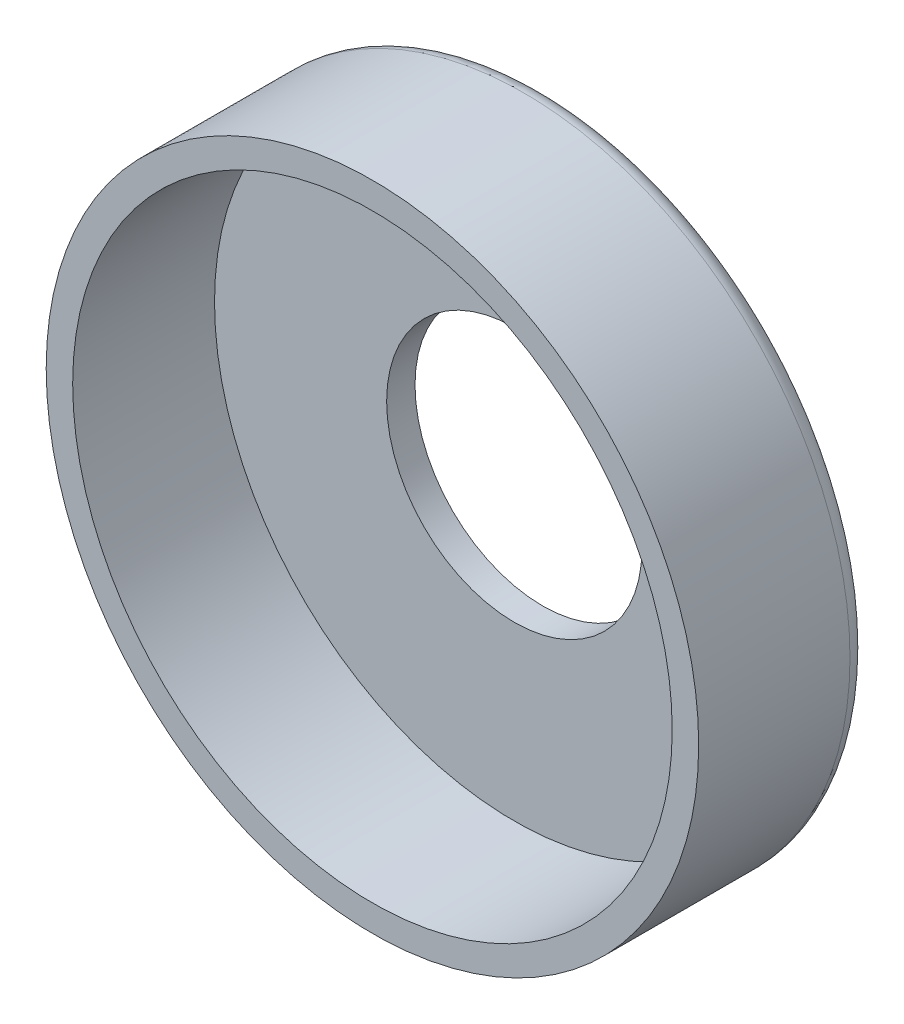
from build123d import *

# Parameters (mm, degrees)
ESQUISSE1_R                  = 34.5
BOSS_EXTRU_1_DEPTH           = 3
ESQUISSE2_R                  = 34.5
ESQUISSE2_R_2                = 31.7
BOSS_EXTRU_2_DEPTH           = 15
ENL_V_MAT_EXTRU_1_DEPTH      = 53.00480747
ENL_V_MAT_EXTRU_1_DEPTH_BACK = 53.00480747
ESQUISSE3_R                  = 13.5
CONG_1_R                     = 2


with BuildPart() as part:
    # Esquisse1 → Boss.-Extru.1 (new body)
    with BuildSketch(Plane.XY):
        Circle(ESQUISSE1_R)
    extrude(amount=BOSS_EXTRU_1_DEPTH)

    # Esquisse2 → Boss.-Extru.2 (add)
    with BuildSketch(Plane.XY.offset(3)):
        Circle(ESQUISSE2_R)
        Circle(ESQUISSE2_R_2, mode=Mode.SUBTRACT)
    extrude(amount=BOSS_EXTRU_2_DEPTH)

    # Esquisse3 → Enlèv. mat.-Extru.1 (cut, two sides: drawn at the far end of the back side and taken through both)
    with BuildSketch(Plane(origin=(0, 0, 0), x_dir=(-1, 0, 0), z_dir=(0, 0, -1)).offset(-ENL_V_MAT_EXTRU_1_DEPTH_BACK)):
        with Locations(Location((0, 0, 0), (0, 0, 180))):
            Circle(ESQUISSE3_R)
    extrude(amount=ENL_V_MAT_EXTRU_1_DEPTH + ENL_V_MAT_EXTRU_1_DEPTH_BACK, mode=Mode.SUBTRACT)

    # Congé1
    cong_1_edges = [part.edges().sort_by_distance(p)[0] for p in [
        (-34.5, 0, 0),
    ]]
    fillet(cong_1_edges, radius=CONG_1_R)


solid = part.part
